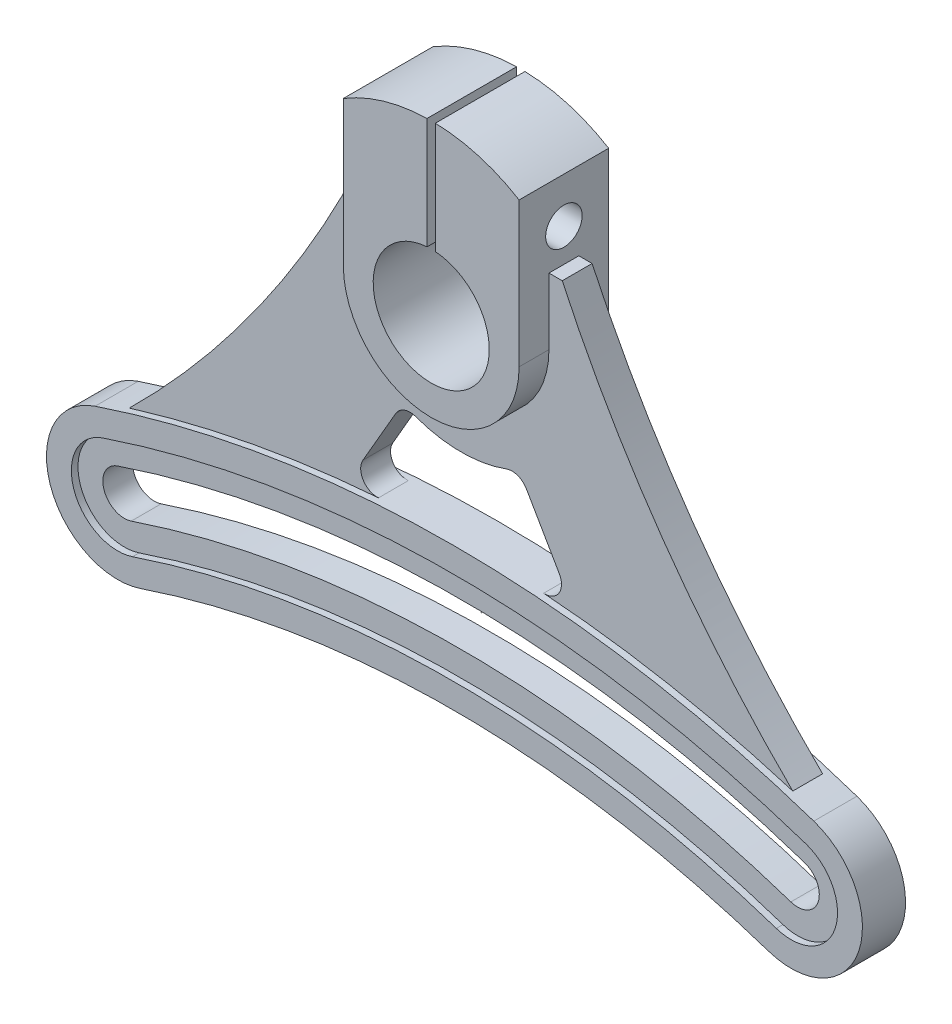
from build123d import *

# Parameters (mm, degrees)
SKETCH_1_R          = 17.5
EXTRUDE_1_DEPTH     = 13.5
SKETCH_2_W          = 2.5
SKETCH_2_H          = 56.398475778
CUT_EXTRUDE_1_DEPTH = 64.5
SKETCH_3_R          = 5.5
CUT_EXTRUDE_2_DEPTH = 75.770900088
EXTRUDE_2_DEPTH     = 6.5
CUT_EXTRUDE_3_DEPTH = 2
SKETCH_6_R          = 0.0005
CUT_EXTRUDE_4_DEPTH = 175.932337555
EXTRUDE_3_DEPTH     = 4.5
FILLET_1_R          = 5
CUT_EXTRUDE_5_DEPTH = 10


with BuildPart() as part:
    # 草图1 → 凸台-拉伸1 (new, symmetric)
    with BuildSketch(Plane.XY):
        with BuildLine():
            Line((-26.5, 0), (-26.5, 43.574648593))
            ThreePointArc((-26.5, 43.574648593), (0, 51), (26.5, 43.574648593))
            Line((26.5, 43.574648593), (26.5, 0))
            ThreePointArc((26.5, 0), (0, -26.5), (-26.5, 0))
        make_face()
        Circle(SKETCH_1_R, mode=Mode.SUBTRACT)
    extrude(amount=EXTRUDE_1_DEPTH, both=True)

    # 草图2 → 切除-拉伸1 (cut, through all)
    with BuildSketch(Plane.XY.offset(13.5)):
        with Locations((0, 36.367769247)):
            Rectangle(SKETCH_2_W, SKETCH_2_H)
    extrude(amount=-CUT_EXTRUDE_1_DEPTH, mode=Mode.SUBTRACT)

    # 草图3 → 切除-拉伸2 (cut, through all)
    with BuildSketch(Plane.ZY.offset(26.5)):
        with Locations((0, 29.984679071)):
            Circle(SKETCH_3_R)
    extrude(amount=-CUT_EXTRUDE_2_DEPTH, mode=Mode.SUBTRACT)



with BuildPart() as body_2:
    # 草图4 → 凸台-拉伸2 (new, symmetric)
    with BuildSketch(Plane.XY):
        with BuildLine():
            ThreePointArc((108.340909091, -81.195883828), (0, -63.5), (-108.340909091, -81.195883828))
            ThreePointArc((-108.340909091, -81.195883828), (-121.88263876, -108.419431679), (-94.659090909, -121.961161348))
            ThreePointArc((-94.659090909, -121.961161348), (0, -106.5), (94.659090909, -121.961161348))
            ThreePointArc((94.659090909, -121.961161348), (121.88263876, -108.419431679), (108.340909091, -81.195883828))
        make_face()
    extrude(amount=EXTRUDE_2_DEPTH, both=True)

    # 草图5 → 切除-拉伸3 (cut)
    with BuildSketch(Plane.XY.offset(6.5)):
        with BuildLine():
            ThreePointArc((105.954545455, -88.306106652), (0, -71), (-105.954545455, -88.306106652))
            ThreePointArc((-105.954545455, -88.306106652), (-114.772415937, -106.033068043), (-97.045454545, -114.850938525))
            ThreePointArc((-97.045454545, -114.850938525), (0, -99), (97.045454545, -114.850938525))
            ThreePointArc((97.045454545, -114.850938525), (114.772415937, -106.033068043), (105.954545455, -88.306106652))
        make_face()
    cut_extrude_3 = extrude(amount=-CUT_EXTRUDE_3_DEPTH, mode=Mode.SUBTRACT)

    # 镜向1: 切除-拉伸3 across plane
    add(cut_extrude_3.mirror(Plane.XY), mode=Mode.SUBTRACT)

    # 草图6 → 切除-拉伸4 (cut, through all)
    with BuildSketch(Plane.XY.offset(4.5)):
        with BuildLine():
            ThreePointArc((103.568181818, -95.416329475), (0, -78.5), (-103.568181818, -95.416329475))
            ThreePointArc((-103.568181818, -95.416329475), (-107.662193113, -103.646704406), (-99.431818182, -107.740715702))
            ThreePointArc((-99.431818182, -107.740715702), (0, -91.5), (99.431818182, -107.740715702))
            ThreePointArc((99.431818182, -107.740715702), (107.662193113, -103.646704406), (103.568181818, -95.416329475))
        make_face()
        with Locations((0, -85)):
            Circle(SKETCH_6_R, mode=Mode.SUBTRACT)
    extrude(amount=-CUT_EXTRUDE_4_DEPTH, mode=Mode.SUBTRACT)


with BuildPart() as cut_extrude_4_piece_1:
    # of the separate pieces the step leaves, piece 1, a body of its own (cut_extrude_4_pieces)
    add(body_2.part.solids().sort_by_distance((94.659090909, -121.961161348, -6.5))[0])


with BuildPart() as cut_extrude_4_piece_2:
    # of the separate pieces the step leaves, piece 2, a body of its own (cut_extrude_4_pieces)
    add(body_2.part.solids().sort_by_distance((0.0005, -85, -4.5))[0])


with BuildPart() as part_1:
    add(part.part)

    add(cut_extrude_4_piece_1.part)  # 凸台-拉伸3 merges 切除-拉伸4 piece 1
    # 草图7 → 凸台-拉伸3 (add, symmetric)
    with BuildSketch(Plane.XY):
        with BuildLine():
            Line((-26.5, 19.984679071), (-30.5, 19.984679071))
            ThreePointArc((-30.5, 19.984679071), (-60.856176916, -32.365550062), (-100, -78.515361346))
            ThreePointArc((-100, -78.515361346), (-67.527443909, -70.26313611), (-34.401068107, -65.242245088))
            Line((-34.401068107, -65.242245088), (-17.5, -35.968736425))
            ThreePointArc((-17.5, -35.968736425), (0, -40), (17.5, -35.968736425))
            Line((17.5, -35.968736425), (34.401068107, -65.242245088))
            ThreePointArc((34.401068107, -65.242245088), (67.527443909, -70.26313611), (100, -78.515361346))
            ThreePointArc((100, -78.515361346), (60.856176916, -32.365550062), (30.5, 19.984679071))
            Line((30.5, 19.984679071), (26.5, 19.984679071))
            Line((26.5, 19.984679071), (26.5, 0))
            ThreePointArc((26.5, 0), (0, -26.5), (-26.5, 0))
            Line((-26.5, 0), (-26.5, 19.984679071))
        make_face()
    extrude(amount=EXTRUDE_3_DEPTH, both=True)

    # 圆角1
    fillet_1_edges = [part_1.edges().sort_by_distance(p)[0] for p in [
        (-34.401068107, -65.242245088, 0),
        (-17.5, -35.968736425, 0),
        (17.5, -35.968736425, 0),
        (34.401068107, -65.242245088, 0),
    ]]
    fillet(fillet_1_edges, radius=FILLET_1_R)

    # 草图8 → 切除-拉伸5 (cut)
    with BuildSketch(Plane.ZY.offset(26.5)):
        Polygon((5.196152423, 38.984679071), (-5.196152423, 38.984679071), (-10.392304845, 29.984679071), (-5.196152423, 20.984679071), (5.196152423, 20.984679071), (10.392304845, 29.984679071), align=None)
    extrude(amount=-CUT_EXTRUDE_5_DEPTH, mode=Mode.SUBTRACT)


solid = Compound([cut_extrude_4_piece_2.part, part_1.part])
